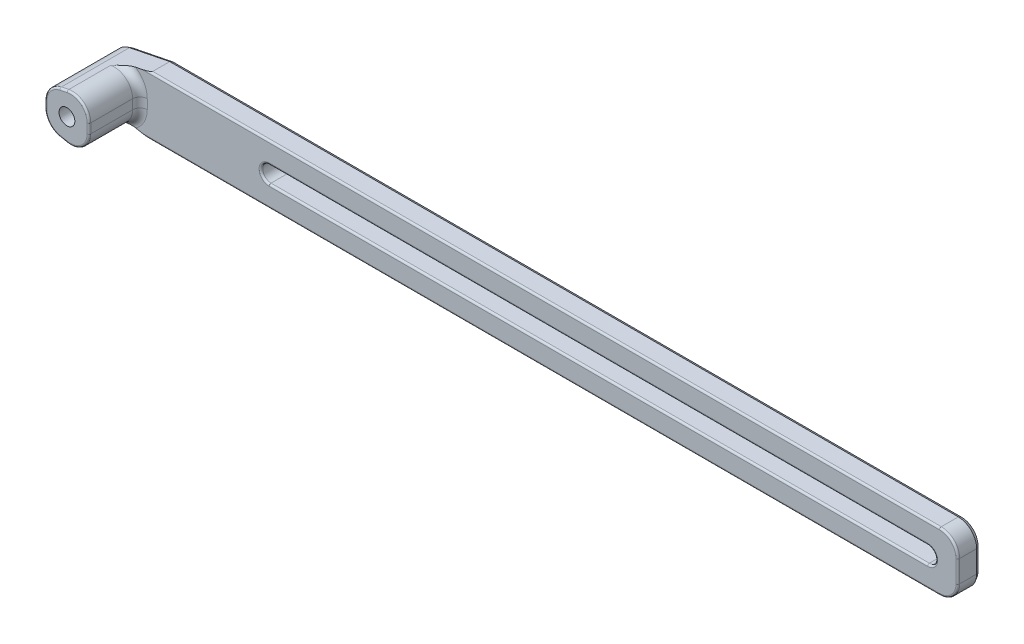
from build123d import *

# Parameters (mm, degrees)
SKETCH1_R           = 2.15
BOSS_EXTRUDE1_DEPTH = 6
SKETCH3_R           = 2.15
BOSS_EXTRUDE2_DEPTH = 13.9
FILLET1_R           = 5
FILLET2_R           = 5
CHAMFER1_SIZE       = 0.5
CHAMFER1_SIZE2      = 0.866025404
FILLET3_R           = 0.5
FILLET4_R           = 2
FILLET5_R           = 0.5


with BuildPart() as part:
    # Sketch1 → Boss-Extrude1 (new body)
    with BuildSketch(Plane.XY):
        Polygon((-110, -8), (110, -8), (110, 8), (-110, 8), (-125, 5), (-125, -5), align=None)
        with Locations((-119, 0)):
            Circle(SKETCH1_R, mode=Mode.SUBTRACT)
        with BuildLine():
            Line((101.75, -2.25), (-77.75, -2.25))
            ThreePointArc((-77.75, -2.25), (-80, 0), (-77.75, 2.25))
            Line((-77.75, 2.25), (101.75, 2.25))
            ThreePointArc((101.75, 2.25), (104, 0), (101.75, -2.25))
        make_face(mode=Mode.SUBTRACT)
    extrude(amount=BOSS_EXTRUDE1_DEPTH)

    # Sketch3 → Boss-Extrude2 (add)
    with BuildSketch(Plane.XY.offset(6)):
        Polygon((-125, 5), (-125, -5), (-113, -7.4), (-113, 7.4), align=None)
        with Locations((-119, 0)):
            Circle(SKETCH3_R, mode=Mode.SUBTRACT)
    extrude(amount=BOSS_EXTRUDE2_DEPTH)

    # Fillet1
    fillet1_edges = [part.edges().sort_by_distance(p)[0] for p in [
        (110, 8, 3),
        (110, -8, 3),
    ]]
    fillet(fillet1_edges, radius=FILLET1_R)

    # Fillet2
    fillet2_edges = [part.edges().sort_by_distance(p)[0] for p in [
        (-125, -5, 9.95),
        (-125, 5, 9.95),
        (-113, 7.4, 12.95),
        (-113, -7.4, 12.95),
    ]]
    fillet(fillet2_edges, radius=FILLET2_R)

    # Chamfer1
    chamfer1_edges = [part.edges().sort_by_distance(p)[0] for p in [
        (-115.490290338, 6.901941932, 0),
        (-2.5, 8, 0),
        (-2.5, -8, 0),
        (12, -2.25, 0),
        (104, 0, 0),
        (12, 2.25, 0),
        (-80, 0, 0),
        (110, 0, 0),
        (108.535533906, 6.535533906, 0),
        (108.535533906, -6.535533906, 0),
        (-115.490290338, -6.901941932, 0),
        (-125, 0, 0),
        (-123.866710707, 4.070925014, 0),
        (-123.866710707, -4.070925014, 0),
    ]]
    chamfer1_side = [part.faces().sort_by_distance(p)[0] for p in [
        (-115.028350448, -4.592242485, 0),
    ]]
    chamfer(chamfer1_edges, length=CHAMFER1_SIZE, length2=CHAMFER1_SIZE2, reference=chamfer1_side[0])

    # Fillet3
    fillet3_edges = [part.edges().sort_by_distance(p)[0] for p in [
        (12, 2.25, 6),
        (104, 0, 6),
        (12, -2.25, 6),
        (-2.5, -8, 6),
        (-2.5, 8, 6),
        (110, 0, 6),
        (108.535533906, 6.535533906, 6),
        (108.535533906, -6.535533906, 6),
        (-80, 0, 6),
    ]]
    fillet(fillet3_edges, radius=FILLET3_R)

    # Fillet4
    fillet4_edges = [part.edges().sort_by_distance(p)[0] for p in [
        (-113, 0, 6),
        (-114.830055472, -5.167691193, 6),
        (-114.830055472, 5.167691193, 6),
    ]]
    fillet(fillet4_edges, radius=FILLET4_R)

    # Fillet5
    fillet5_edges = [part.edges().sort_by_distance(p)[0] for p in [
        (-113, 0, 19.9),
        (-119.980580676, -6.003883865, 19.9),
        (-119.980580676, 6.003883865, 19.9),
        (-125, 0, 19.9),
        (-123.866710707, 4.070925014, 19.9),
        (-123.866710707, -4.070925014, 19.9),
        (-114.830055472, 5.167691193, 19.9),
        (-114.830055472, -5.167691193, 19.9),
    ]]
    fillet(fillet5_edges, radius=FILLET5_R)


solid = part.part
